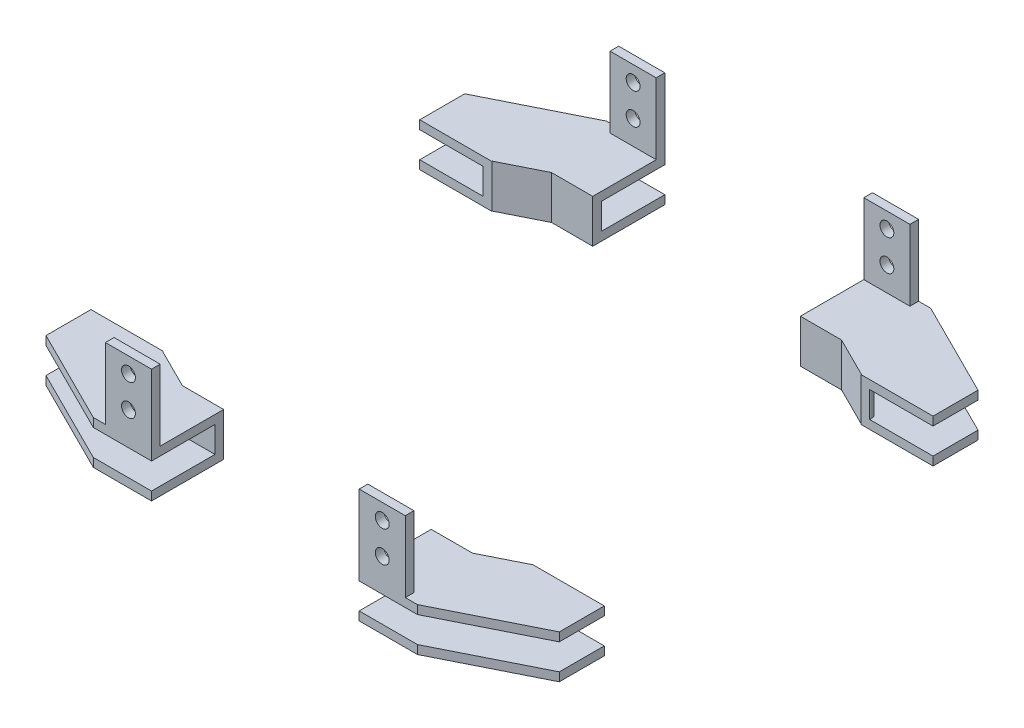
from build123d import *

# Parameters (mm, degrees)
BOSS_EXTRUDE1_DEPTH     = 2.25
BOSS_EXTRUDE2_DEPTH     = 1.5
CUT_EXTRUDE1_DEPTH      = 64.044131368
CUT_EXTRUDE1_DEPTH_BACK = 64.044131368
BOSS_EXTRUDE3_START     = 44.5
SKETCH5_W               = 8
SKETCH5_H               = 12.3
BOSS_EXTRUDE3_DEPTH     = 1.5
BOSS_EXTRUDE4_START     = -44.5
SKETCH5_2_W             = 8
SKETCH5_2_H             = 12.3
BOSS_EXTRUDE4_DEPTH     = 1.5
CUT_EXTRUDE3_DEPTH      = 65.946920635
CUT_EXTRUDE3_DEPTH_BACK = 65.946920635
SKETCH6_R               = 1.2
CUT_EXTRUDE6_DEPTH      = 65.946920635
CUT_EXTRUDE6_DEPTH_BACK = 65.946920635
SKETCH7_W               = 89
SKETCH7_H               = 57
CUT_EXTRUDE7_DEPTH      = 65.946920635
CUT_EXTRUDE7_DEPTH_BACK = 65.946920635
SKETCH8_W               = 36
SKETCH8_H               = 89
FILLET1_R               = 1
FILLET2_R               = 1
FILLET3_R               = 1
FILLET4_R               = 1


with BuildPart() as part:
    # Sketch1 → Boss-Extrude1 (new, symmetric)
    with BuildSketch(Plane(origin=(0, 0, 0), x_dir=(1, 0, 0), z_dir=(0, 1, 0))):
        Polygon((-25.5, -33.5), (25.5, -33.5), (33.5, -29.5), (33.5, 29.5), (25.5, 33.5), (-25.5, 33.5), (-33.5, 29.5), (-33.5, -29.5), align=None)
    extrude(amount=BOSS_EXTRUDE1_DEPTH, both=True)

    # Sketch2 → Boss-Extrude2 (add)
    with BuildSketch(Plane(origin=(0, 2.25, 0), x_dir=(1, 0, 0), z_dir=(0, 1, 0))):
        Polygon((28.096747752, -44.5), (44.5, -36.298373876), (44.5, 36.298373876), (28.096747752, 44.5), (-28.096747752, 44.5), (-44.5, 36.298373876), (-44.5, -36.298373876), (-28.096747752, -44.5), align=None)
    boss_extrude2 = extrude(amount=BOSS_EXTRUDE2_DEPTH)

    # Mirror1: Boss-Extrude2 across plane
    add(boss_extrude2.mirror(Plane.ZX))

    # Sketch3 → Cut-Extrude1 (cut, two sides: drawn at the far end of the back side and taken through both)
    with BuildSketch(Plane(origin=(0, 0, 0), x_dir=(1, 0, 0), z_dir=(0, 1, 0)).offset(-CUT_EXTRUDE1_DEPTH_BACK)):
        Polygon((-25.145898034, -32), (25.145898034, -32), (32, -28.572949017), (32, 28.572949017), (25.145898034, 32), (-25.145898034, 32), (-32, 28.572949017), (-32, -28.572949017), align=None)
    extrude(amount=CUT_EXTRUDE1_DEPTH + CUT_EXTRUDE1_DEPTH_BACK, mode=Mode.SUBTRACT)

    # Sketch5 → Boss-Extrude3 (add)
    with BuildSketch(Plane.XY.offset(BOSS_EXTRUDE3_START)):
        with Locations((-22, 9.9)):
            Rectangle(SKETCH5_W, SKETCH5_H)
        with Locations((22, 9.9)):
            Rectangle(SKETCH5_W, SKETCH5_H)
    extrude(amount=-BOSS_EXTRUDE3_DEPTH)

    # Sketch5<2> → Boss-Extrude4 (add)
    with BuildSketch(Plane.XY.offset(BOSS_EXTRUDE4_START)):
        with Locations((-22, 9.9)):
            Rectangle(SKETCH5_2_W, SKETCH5_2_H)
        with Locations((22, 9.9)):
            Rectangle(SKETCH5_2_W, SKETCH5_2_H)
    extrude(amount=BOSS_EXTRUDE4_DEPTH)

    # Sketch6 → Cut-Extrude3 (cut, two sides: drawn at the far end of the back side and taken through both)
    with BuildSketch(Plane.XY.offset(-CUT_EXTRUDE3_DEPTH_BACK)):
        with Locations((-22, 13.35)):
            Circle(SKETCH6_R)
        with Locations((22, 13.35)):
            Circle(SKETCH6_R)
        with Locations((22, 7.95)):
            Circle(SKETCH6_R)
        with Locations((-22, 7.95)):
            Circle(SKETCH6_R)
    extrude(amount=CUT_EXTRUDE3_DEPTH + CUT_EXTRUDE3_DEPTH_BACK, mode=Mode.SUBTRACT)

    # Sketch7 → Cut-Extrude6 (cut, two sides: drawn at the far end of the back side and taken through both)
    with BuildSketch(Plane(origin=(0, 0, 0), x_dir=(1, 0, 0), z_dir=(0, 1, 0)).offset(-CUT_EXTRUDE6_DEPTH_BACK)):
        Rectangle(SKETCH7_W, SKETCH7_H)
    extrude(amount=CUT_EXTRUDE6_DEPTH + CUT_EXTRUDE6_DEPTH_BACK, mode=Mode.SUBTRACT)


with BuildPart() as cut_extrude6_piece_1:
    # of the separate pieces the step leaves, piece 1, a body of its own (cut_extrude6_pieces)
    add(part.part.solids().sort_by_distance((28.096747752, -2.25, 44.5))[0])


with BuildPart() as cut_extrude6_piece_2:
    # of the separate pieces the step leaves, piece 2, a body of its own (cut_extrude6_pieces)
    add(part.part.solids().sort_by_distance((44.5, -2.25, -28.5))[0])


with BuildPart() as cut_extrude7_tool:
    # Sketch8 → Cut-Extrude7 (new, two sides: drawn at the far end of the back side and taken through both)
    with BuildSketch(Plane(origin=(0, 0, 0), x_dir=(1, 0, 0), z_dir=(0, 1, 0)).offset(-CUT_EXTRUDE7_DEPTH_BACK)):
        Rectangle(SKETCH8_W, SKETCH8_H)
    extrude(amount=CUT_EXTRUDE7_DEPTH + CUT_EXTRUDE7_DEPTH_BACK)


with BuildPart() as cut_extrude6_piece_1_1:
    add(cut_extrude6_piece_1.part)

    # Cut-Extrude7: cut by cut_extrude7_tool
    add(cut_extrude7_tool.part, mode=Mode.SUBTRACT)


with BuildPart() as cut_extrude6_piece_2_1:
    add(cut_extrude6_piece_2.part)

    # Cut-Extrude7: cut by cut_extrude7_tool
    add(cut_extrude7_tool.part, mode=Mode.SUBTRACT)


with BuildPart() as cut_extrude7_piece_1:
    # of the separate pieces the step leaves, piece 1, a body of its own (cut_extrude7_pieces)
    add(cut_extrude6_piece_1_1.part.solids().sort_by_distance((28.096747752, -2.25, 44.5))[0])

    # Fillet1
    fillet1_edges = [cut_extrude7_piece_1.edges().sort_by_distance(p)[0] for p in [
        (33.5, 0, 29.5),
        (25.5, 0, 33.5),
    ]]
    fillet(fillet1_edges, radius=FILLET1_R)


with BuildPart() as cut_extrude7_piece_2:
    # of the separate pieces the step leaves, piece 2, a body of its own (cut_extrude7_pieces)
    add(cut_extrude6_piece_1_1.part.solids().sort_by_distance((-28.096747752, -2.25, 44.5))[0])

    # Fillet4
    fillet4_edges = [cut_extrude7_piece_2.edges().sort_by_distance(p)[0] for p in [
        (-33.5, 0, 29.5),
        (-25.5, 0, 33.5),
    ]]
    fillet(fillet4_edges, radius=FILLET4_R)


with BuildPart() as cut_extrude7_piece_1_of_cut_extrude6_pie:
    # of the separate pieces the step leaves, piece 1, a body of its own (cut_extrude7_pieces_of_cut_extrude6_piec)
    add(cut_extrude6_piece_2_1.part.solids().sort_by_distance((44.5, -2.25, -28.5))[0])

    # Fillet2
    fillet2_edges = [cut_extrude7_piece_1_of_cut_extrude6_pie.edges().sort_by_distance(p)[0] for p in [
        (25.5, 0, -33.5),
        (33.5, 0, -29.5),
    ]]
    fillet(fillet2_edges, radius=FILLET2_R)


with BuildPart() as cut_extrude7_piece_2_of_cut_extrude6_pie:
    # of the separate pieces the step leaves, piece 2, a body of its own (cut_extrude7_pieces_of_cut_extrude6_piec)
    add(cut_extrude6_piece_2_1.part.solids().sort_by_distance((-18, -2.25, -33.5))[0])

    # Fillet3
    fillet3_edges = [cut_extrude7_piece_2_of_cut_extrude6_pie.edges().sort_by_distance(p)[0] for p in [
        (-33.5, 0, -29.5),
        (-25.5, 0, -33.5),
    ]]
    fillet(fillet3_edges, radius=FILLET3_R)


solid = Compound([cut_extrude7_piece_1.part, cut_extrude7_piece_2.part, cut_extrude7_piece_1_of_cut_extrude6_pie.part, cut_extrude7_piece_2_of_cut_extrude6_pie.part])
